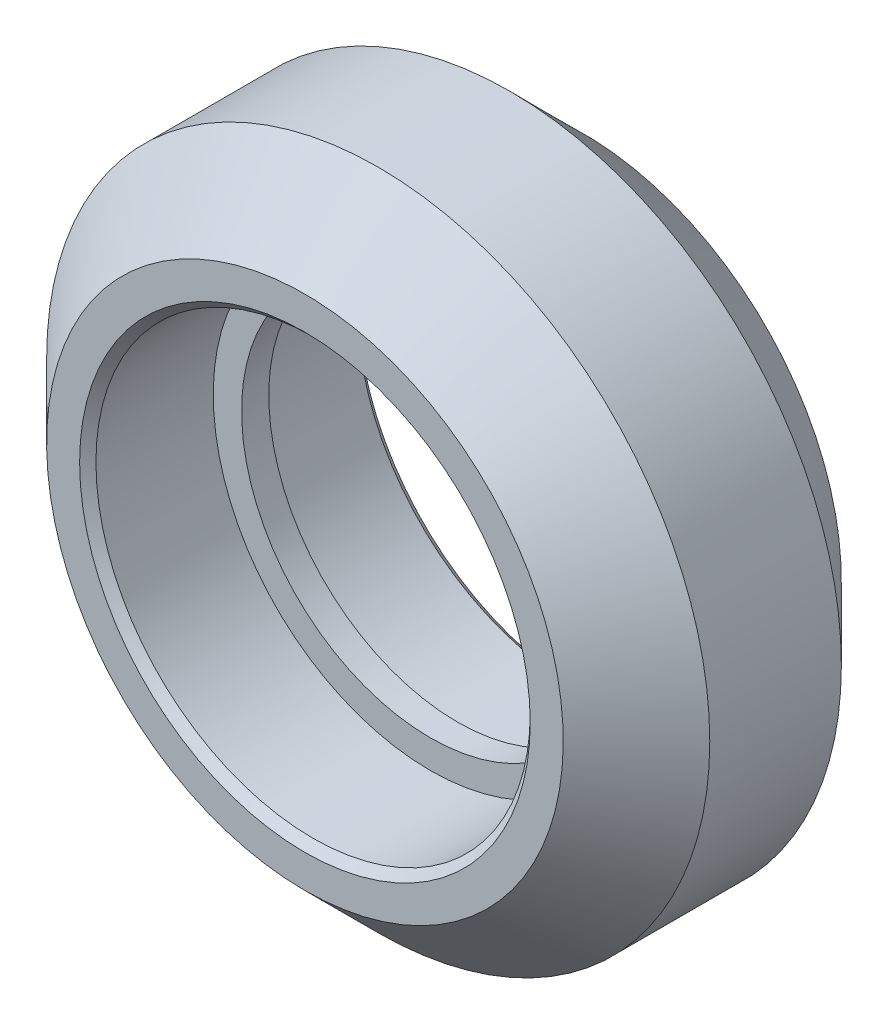
from build123d import *

# Parameters (mm, degrees)
CHAMFER1_SIZE = 0.3


with BuildPart() as part:
    # Sketch1 → Revolve1 (revolve)
    with BuildSketch(Plane(origin=(0, 0, 0), x_dir=(0, 0, -1), z_dir=(1, 0, 0)), mode=Mode.PRIVATE) as revolve1_sk:
        Polygon((-2.42, 12.195), (2.42, 12.195), (5.115, 9.5), (5.115, 7.987), (0.5, 7.987), (0.5, 6.945), (-0.5, 6.945), (-0.5, 7.987), (-5.115, 7.987), (-5.115, 9.5), align=None)
    revolve(revolve1_sk.sketch.rotate(Axis((0, 0, 5.115), (0, 0, -1)), 180), axis=Axis((0, 0, 5.115), (0, 0, -1)))

    # Chamfer1
    chamfer1_edges = [part.edges().sort_by_distance(p)[0] for p in [
        (0, 7.987, 5.115),
        (0, 7.987, -5.115),
    ]]
    chamfer(chamfer1_edges, length=CHAMFER1_SIZE)


solid = part.part
